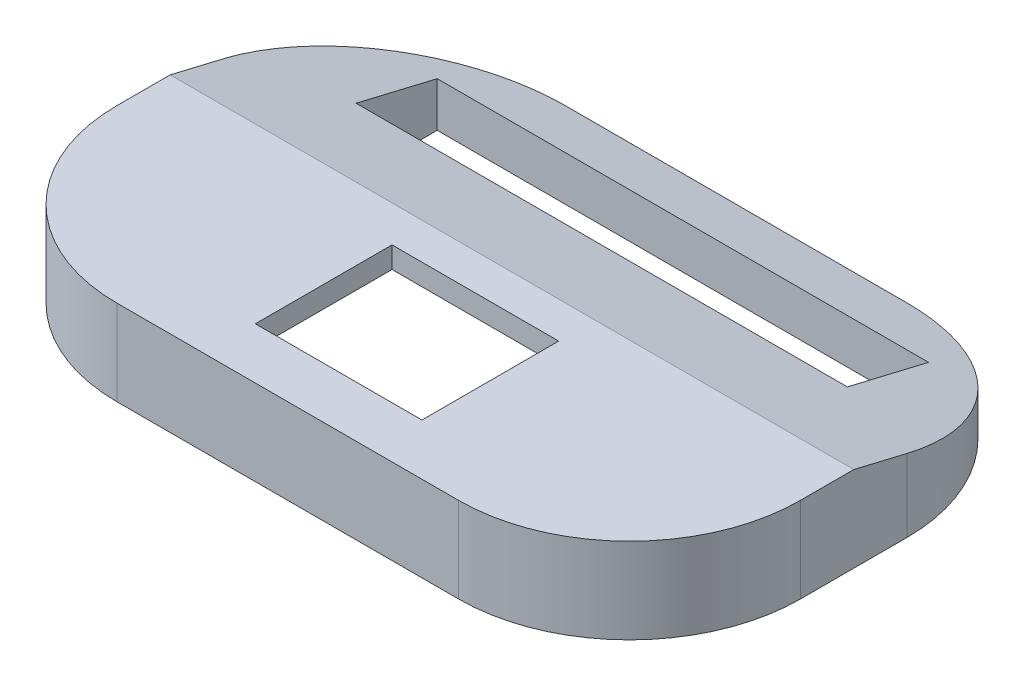
from build123d import *

# Parameters (mm, degrees)
BOSS_EXTRUDE1_DEPTH = 20
SKETCH5_W           = 39
SKETCH5_H           = 32
CUT_EXTRUDE1_DEPTH  = 98.75607398
SKETCH6_W           = 59
SKETCH6_H           = 54.995658629
CUT_EXTRUDE2_DEPTH  = 15
SKETCH7_W           = 115
SKETCH7_H           = 80
CUT_EXTRUDE3_DEPTH  = 15
SKETCH8_OUTSIDE_W   = 145.484
SKETCH8_OUTSIDE_H   = 60.484
CUT_EXTRUDE4_DEPTH  = 170.576678821


with BuildPart() as part:
    # Sketch1 → Boss-Extrude1 (new body)
    with BuildSketch(Plane(origin=(0, 0, 0), x_dir=(1, 0, 0), z_dir=(0, 1, 0))):
        with BuildLine():
            Line((40, -52.5), (-40, -52.5))
            ThreePointArc((-40, -52.5), (-68.284271247, -40.784271247), (-80, -12.5))
            Line((-80, -12.5), (-80, 12.5))
            ThreePointArc((-80, 12.5), (-68.284271247, 40.784271247), (-40, 52.5))
            Line((-40, 52.5), (40, 52.5))
            ThreePointArc((40, 52.5), (68.284271247, 40.784271247), (80, 12.5))
            Line((80, 12.5), (80, -12.5))
            ThreePointArc((80, -12.5), (68.284271247, -40.784271247), (40, -52.5))
        make_face()
    extrude(amount=BOSS_EXTRUDE1_DEPTH)

    # Sketch5 → Cut-Extrude1 (cut, through all)
    with BuildSketch(Plane(origin=(0, 20, 0), x_dir=(1, 0, 0), z_dir=(0, 1, 0))):
        with Locations((-0.079334532, -24.5)):
            Rectangle(SKETCH5_W, SKETCH5_H)
    extrude(amount=-CUT_EXTRUDE1_DEPTH, mode=Mode.SUBTRACT)

    # Sketch6 → Cut-Extrude2 (cut)
    with BuildSketch(Plane.XZ):
        with Locations((-0.079334532, 15.997829315)):
            Rectangle(SKETCH6_W, SKETCH6_H)
    extrude(amount=-CUT_EXTRUDE2_DEPTH, mode=Mode.SUBTRACT)

    # Sketch7 → Cut-Extrude3 (cut)
    with BuildSketch(Plane.XZ):
        Rectangle(SKETCH7_W, SKETCH7_H)
    extrude(amount=-CUT_EXTRUDE3_DEPTH, mode=Mode.SUBTRACT)

    # Sketch8 outside → Cut-Extrude4 (cut, through all)
    with BuildSketch(Plane(origin=(80, 0, 0), x_dir=(0, 0, -1), z_dir=(1, 0, 0))):
        with Locations((0, 10)):
            Rectangle(SKETCH8_OUTSIDE_W, SKETCH8_OUTSIDE_H)
        Polygon((0, 20), (52.5, 7.5), (52.5, 0), (-27.5, 0), (-52.5, 0), (-52.5, 20), (-27.5, 20), align=None, mode=Mode.SUBTRACT)
    extrude(amount=-CUT_EXTRUDE4_DEPTH, mode=Mode.SUBTRACT)


solid = part.part
